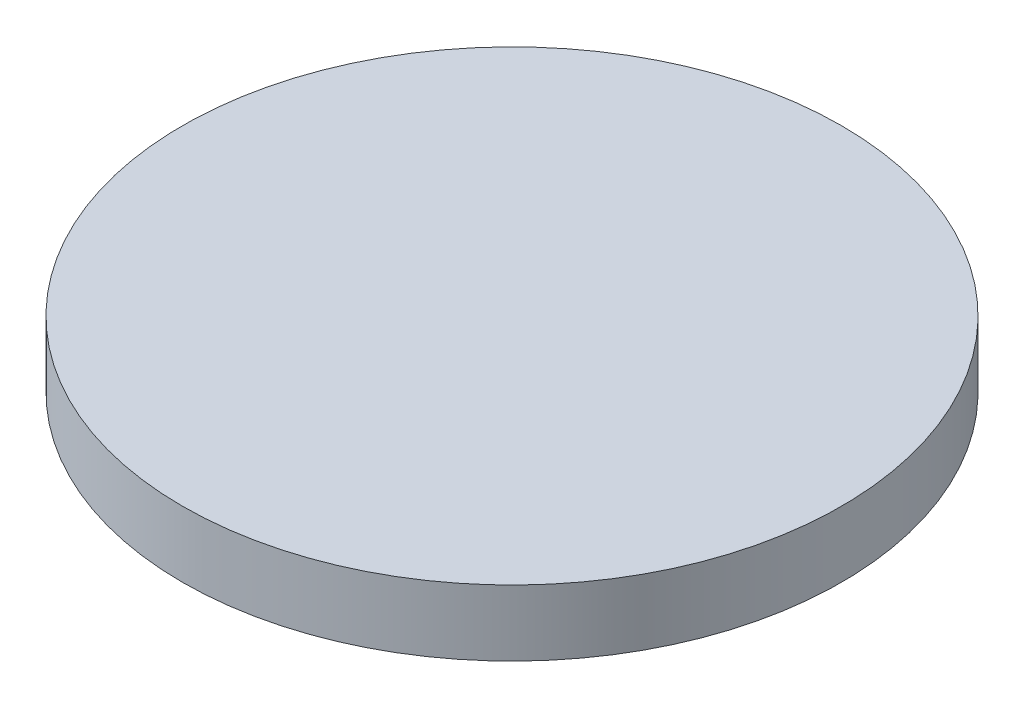
from build123d import *

# Parameters (mm, degrees)
SKETCH1_R           = 95.25
BOSS_EXTRUDE1_DEPTH = 19.05


with BuildPart() as part:
    # Sketch1 → Boss-Extrude1 (new body)
    with BuildSketch(Plane(origin=(0, 0, 0), x_dir=(1, 0, 0), z_dir=(0, 1, 0))):
        with Locations(Location((0, 0, 0), (0, 0, 90))):
            Circle(SKETCH1_R)
    extrude(amount=BOSS_EXTRUDE1_DEPTH)


solid = part.part
